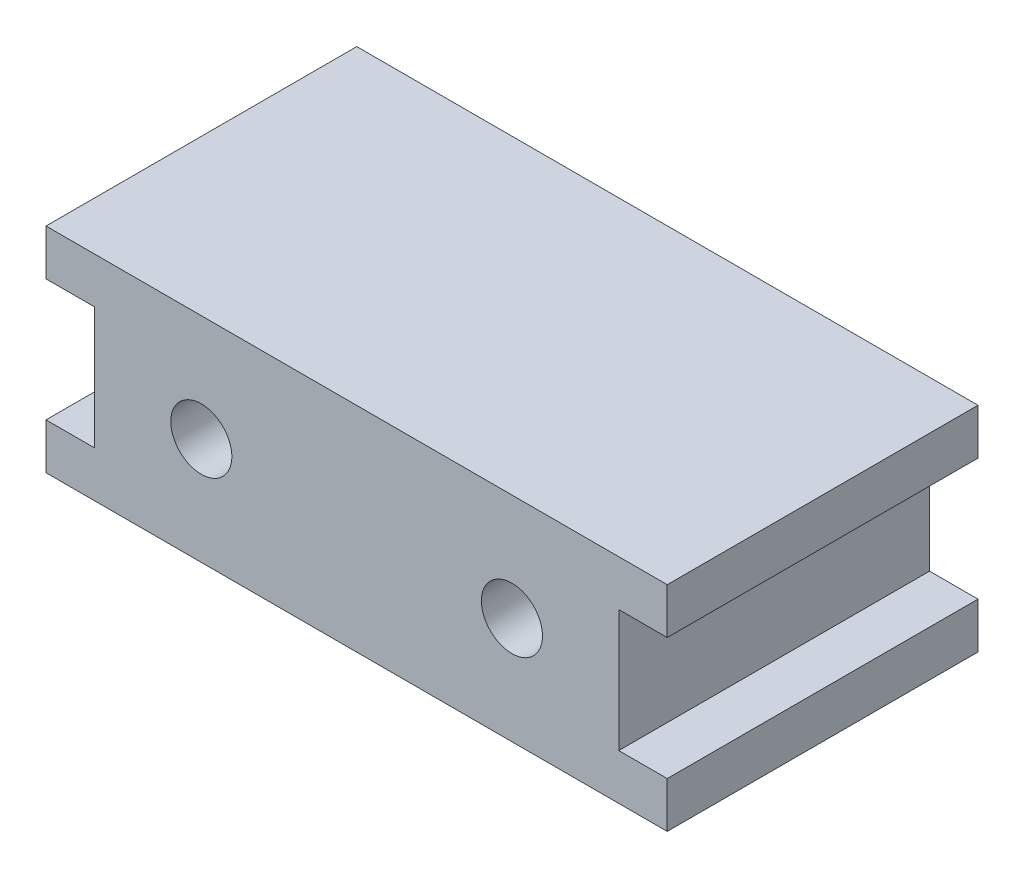
from build123d import *

# Parameters (mm, degrees)
SKETCH1_R           = 4
BOSS_EXTRUDE1_DEPTH = 40.72


with BuildPart() as part:
    # Sketch1 → Boss-Extrude1 (new body)
    with BuildSketch(Plane.XY):
        Polygon((40.7, -3.677490775), (40.7, -9.677490775), (-40.7, -9.677490775), (-40.7, -3.677490775), (-34.35, -3.677490775), (-34.35, 12.322509225), (-40.7, 12.322509225), (-40.7, 18.322509225), (40.7, 18.322509225), (40.7, 12.322509225), (34.35, 12.322509225), (34.35, -3.677490775), align=None)
        with Locations((20.35, 4.322509225)):
            Circle(SKETCH1_R, mode=Mode.SUBTRACT)
        with Locations(Location((-20.35, 4.322509225, 0), (0, 0, 180))):
            Circle(SKETCH1_R, mode=Mode.SUBTRACT)
    extrude(amount=-BOSS_EXTRUDE1_DEPTH)


solid = part.part
